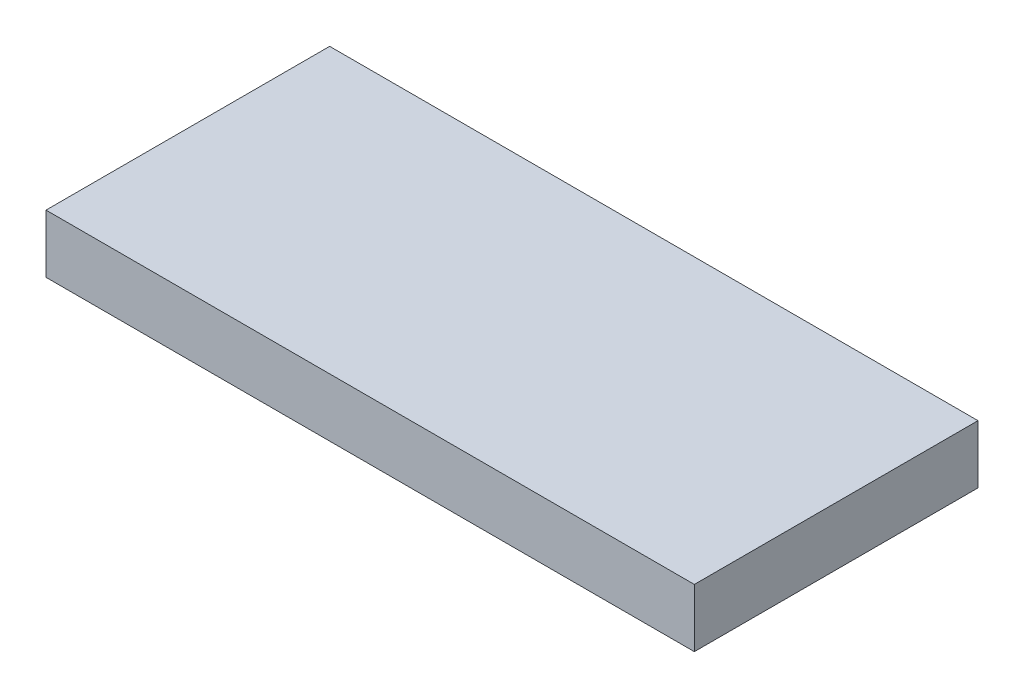
from build123d import *

# Parameters (mm, degrees)
SKETCH1_W           = 203.2
SKETCH1_H           = 88.9
BOSS_EXTRUDE1_DEPTH = 18.25625


with BuildPart() as part:
    # Sketch1 → Boss-Extrude1 (new body)
    with BuildSketch(Plane(origin=(0, 0, 0), x_dir=(1, 0, 0), z_dir=(0, 1, 0))):
        Rectangle(SKETCH1_W, SKETCH1_H)
    extrude(amount=BOSS_EXTRUDE1_DEPTH)


solid = part.part
